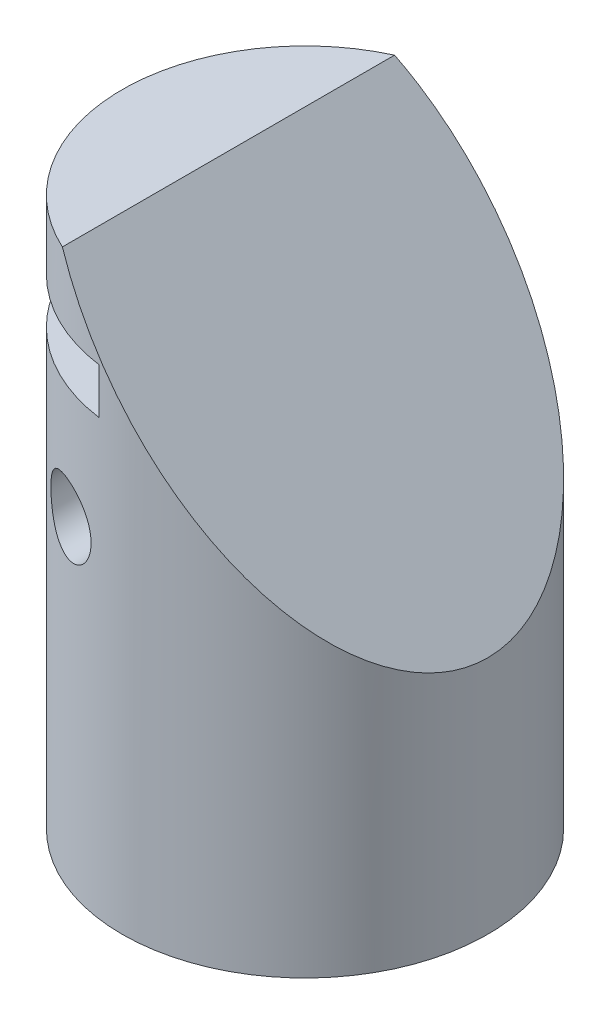
from build123d import *

# Parameters (mm, degrees)
BOSS_EXTRUDE1_START = 20
SKETCH1_R           = 40
BOSS_EXTRUDE1_DEPTH = 120
CUT_EXTRUDE1_START  = 20
SKETCH1_4_R         = 25
CUT_EXTRUDE1_DEPTH  = 40
SKETCH2_R           = 7.5
SKETCH2_W           = 36.544112996
SKETCH2_H           = 10
CUT_EXTRUDE2_DEPTH  = 262.537261524


with BuildPart() as part:
    # Sketch1 → Boss-Extrude1 (new body)
    with BuildSketch(Plane(origin=(0, 0, 0), x_dir=(1, 0, 0), z_dir=(0, 1, 0)).offset(BOSS_EXTRUDE1_START)):
        with Locations(Location((131.582372263, -99.144632286, 0), (0, 0, 270))):
            Circle(SKETCH1_R)
    extrude(amount=BOSS_EXTRUDE1_DEPTH)

    # Sketch1<4> → Cut-Extrude1 (cut)
    with BuildSketch(Plane(origin=(0, 0, 0), x_dir=(1, 0, 0), z_dir=(0, 1, 0)).offset(CUT_EXTRUDE1_START)):
        with Locations(Location((131.582372263, -99.144632286, 0), (0, 0, 270))):
            Circle(SKETCH1_4_R)
    extrude(amount=CUT_EXTRUDE1_DEPTH, mode=Mode.SUBTRACT)

    # Sketch2 → Cut-Extrude2 (cut, through all)
    with BuildSketch(Plane.XY):
        with Locations(Location((116.582372263, 90, 0), (0, 0, 180))):
            Circle(SKETCH2_R)
        Polygon((113.167198818, 142), (173.582372263, 70), (173.582372263, 142), align=None)
        with Locations((107.854428761, 120)):
            Rectangle(SKETCH2_W, SKETCH2_H)
    extrude(amount=CUT_EXTRUDE2_DEPTH, mode=Mode.SUBTRACT)


solid = part.part
